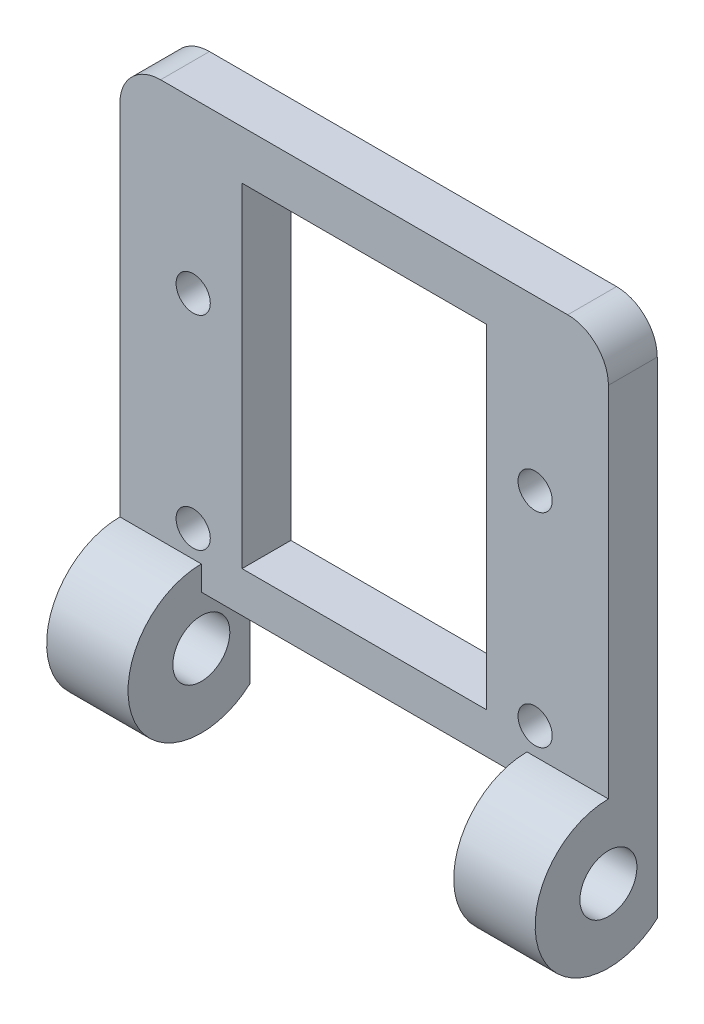
from build123d import *

# Parameters (mm, degrees)
ESQUISSE1_W        = 30
ESQUISSE1_H        = 26
ESQUISSE1_R        = 1.05
ESQUISSE1_W_2      = 15
ESQUISSE1_H_2      = 20.5
BOSS_EXTRU_1_DEPTH = 3
CONG_1_R           = 2.5
ESQUISSE3_R        = 1.75
BOSS_EXTRU_3_DEPTH = 5


with BuildPart() as part:
    # Esquisse1 → Boss.-Extru.1 (new body)
    with BuildSketch(Plane.XY):
        Rectangle(ESQUISSE1_W, ESQUISSE1_H)
        with Locations((-10.5, 2.638)):
            Circle(ESQUISSE1_R, mode=Mode.SUBTRACT)
        with Locations((10.5, 2.638)):
            Circle(ESQUISSE1_R, mode=Mode.SUBTRACT)
        with Locations((-10.5, -9.862)):
            Circle(ESQUISSE1_R, mode=Mode.SUBTRACT)
        with Locations((10.5, -9.862)):
            Circle(ESQUISSE1_R, mode=Mode.SUBTRACT)
        with Locations((0, -0.25)):
            Rectangle(ESQUISSE1_W_2, ESQUISSE1_H_2, mode=Mode.SUBTRACT)
    extrude(amount=BOSS_EXTRU_1_DEPTH)

    # Congé1
    cong_1_edges = [part.edges().sort_by_distance(p)[0] for p in [
        (15, 13, 1.5),
        (-15, 13, 1.5),
    ]]
    fillet(cong_1_edges, radius=CONG_1_R)

    # Esquisse3 → Boss.-Extru.3 (add)
    with BuildSketch(Plane(origin=(15, 0, 0), x_dir=(0, 0, -1), z_dir=(1, 0, 0))):
        with BuildLine():
            ThreePointArc((-3, -11.5), (-7.203775615, -17.605699404), (0, -19.354101966))
            Line((0, -19.354101966), (0, -13))
            Line((0, -13), (-3, -13))
            Line((-3, -13), (-3, -11.5))
        make_face()
        with Locations(Location((-3, -16, 0), (0, 0, 90))):
            Circle(ESQUISSE3_R, mode=Mode.SUBTRACT)
    boss_extru_3 = extrude(amount=-BOSS_EXTRU_3_DEPTH)

    # Symétrie2: Boss.-Extru.3 across plane
    add(boss_extru_3.mirror(Plane(origin=(0, 0, 0), x_dir=(0, 0, 1), z_dir=(1, 0, 0))))


solid = part.part
